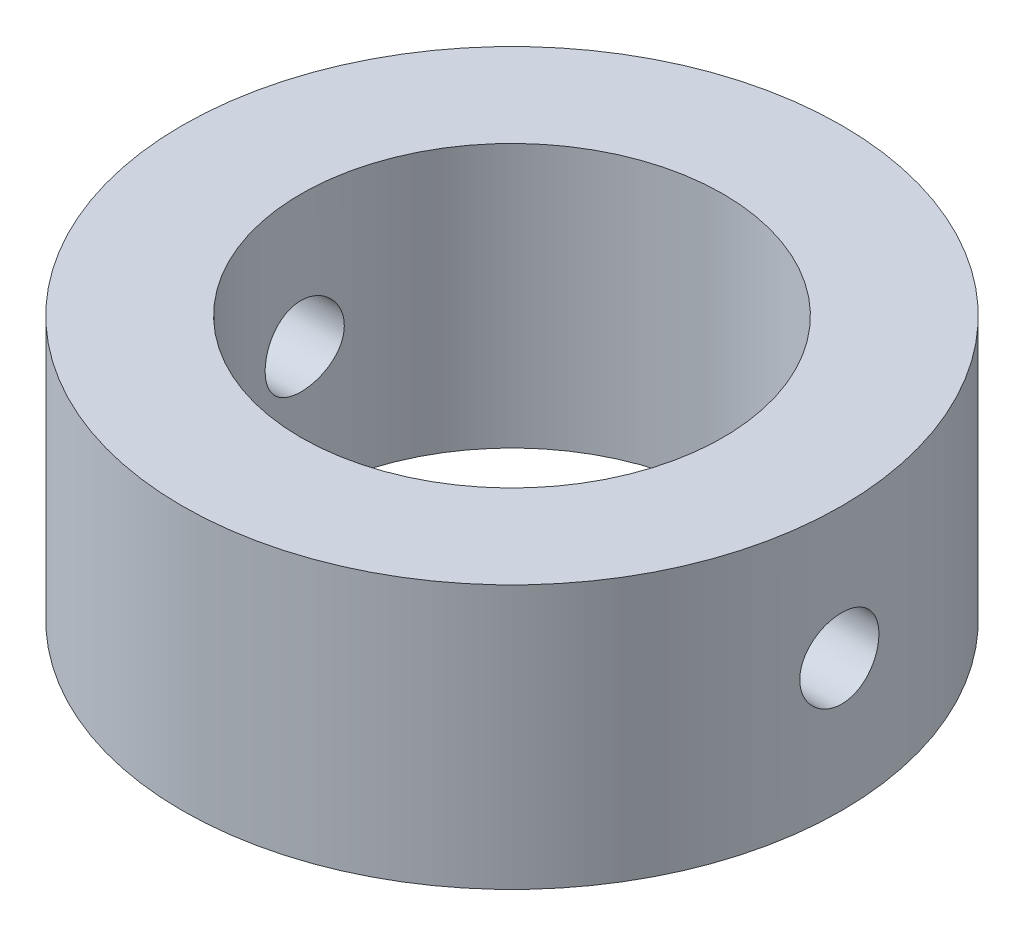
from build123d import *

# Parameters (mm, degrees)
SKETCH1_R           = 12.5
SKETCH1_R_2         = 8
BOSS_EXTRUDE1_DEPTH = 10
SKETCH3_R           = 1.5
CUT_EXTRUDE1_DEPTH  = 30.685855218
ESCALA1_SCALE       = 0.5


with BuildPart() as part:
    # Sketch1 → Boss-Extrude1 (new body)
    with BuildSketch(Plane(origin=(0, 0, 0), x_dir=(1, 0, 0), z_dir=(0, 1, 0))):
        with Locations(Location((0, 0, 0), (0, 0, 270))):
            Circle(SKETCH1_R)
        with Locations(Location((0, 0, 0), (0, 0, 270))):
            Circle(SKETCH1_R_2, mode=Mode.SUBTRACT)
    extrude(amount=BOSS_EXTRUDE1_DEPTH)

    # Sketch3 → Cut-Extrude1 (cut, through all)
    with BuildSketch(Plane.ZY.offset(12.5)):
        with Locations((0, 5)):
            Circle(SKETCH3_R)
    extrude(amount=-CUT_EXTRUDE1_DEPTH, mode=Mode.SUBTRACT)


with BuildPart() as part_1:
    # Escala1: scaled about (2.9522e-05, 5.000004154, -4.1694e-05)
    add(part.part.scale(ESCALA1_SCALE).moved(Location((1.4761e-05, 2.500002077, -2.0847e-05))))


solid = part_1.part
